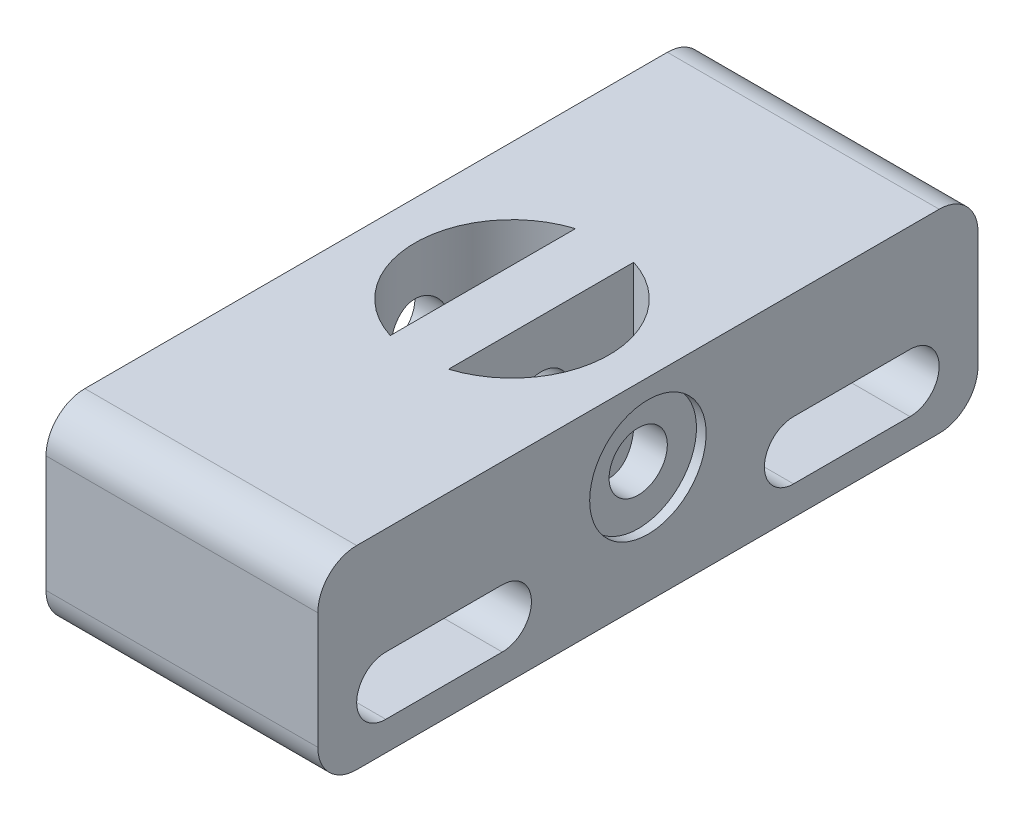
from build123d import *

# Parameters (mm, degrees)
SKETCH_1_W          = 14
SKETCH_1_H          = 34
EXTRUDE_1_DEPTH     = 10
SKETCH_2_R          = 1.5
CUT_EXTRUDE_1_DEPTH = 25.186773245
SKETCH_3_R          = 3
CUT_EXTRUDE_2_DEPTH = 0.5
CUT_EXTRUDE_3_DEPTH = 25.186773286
FILLET_1_R          = 2
CHAMFER_1_SIZE      = 0.6


with BuildPart() as part:
    # 草图1 → 凸台-拉伸1 (new body)
    with BuildSketch(Plane(origin=(0, 0, 0), x_dir=(1, 0, 0), z_dir=(0, 1, 0))):
        Rectangle(SKETCH_1_W, SKETCH_1_H)
        with BuildLine():
            Line((-1.5, 4.769696007), (-1.5, -4.769696007))
            ThreePointArc((-1.5, -4.769696007), (-5, 0), (-1.5, 4.769696007))
        make_face(mode=Mode.SUBTRACT)
        with BuildLine():
            Line((1.5, 4.769696007), (1.5, -4.769696007))
            ThreePointArc((1.5, -4.769696007), (5, 0), (1.5, 4.769696007))
        make_face(mode=Mode.SUBTRACT)
    extrude(amount=EXTRUDE_1_DEPTH)

    # 草图2 → 切除-拉伸1 (cut, through all)
    with BuildSketch(Plane.ZY.offset(7)):
        with Locations((0, 6)):
            Circle(SKETCH_2_R)
    extrude(amount=-CUT_EXTRUDE_1_DEPTH, mode=Mode.SUBTRACT)

    # 草图3 → 切除-拉伸2 (cut)
    with BuildSketch(Plane.ZY.offset(7)):
        with Locations((0, 6)):
            Circle(SKETCH_3_R)
    cut_extrude_2 = extrude(amount=-CUT_EXTRUDE_2_DEPTH, mode=Mode.SUBTRACT)

    # 镜向1: 切除-拉伸2 across plane
    add(cut_extrude_2.mirror(Plane(origin=(0, 0, 0), x_dir=(0, 0, 1), z_dir=(1, 0, 0))), mode=Mode.SUBTRACT)

    # 草图4 → 切除-拉伸3 (cut, through all)
    with BuildSketch(Plane.ZY.offset(7)):
        with BuildLine():
            Line((-13.5, 4.5), (-7.5, 4.5))
            ThreePointArc((-7.5, 4.5), (-6, 3), (-7.5, 1.5))
            Line((-7.5, 1.5), (-13.5, 1.5))
            ThreePointArc((-13.5, 1.5), (-15, 3), (-13.5, 4.5))
        make_face()
        with BuildLine():
            Line((7.5, 1.5), (13.5, 1.5))
            ThreePointArc((13.5, 1.5), (15, 3), (13.5, 4.5))
            Line((13.5, 4.5), (7.5, 4.5))
            ThreePointArc((7.5, 4.5), (6, 3), (7.5, 1.5))
        make_face()
    extrude(amount=-CUT_EXTRUDE_3_DEPTH, mode=Mode.SUBTRACT)

    # 圆角1
    fillet_1_edges = [part.edges().sort_by_distance(p)[0] for p in [
        (0, 10, 17),
        (0, 0, 17),
        (0, 0, -17),
        (0, 10, -17),
    ]]
    fillet(fillet_1_edges, radius=FILLET_1_R)

    # 倒角1
    chamfer_1_edges = [part.edges().sort_by_distance(p)[0] for p in [
        (5, 0, 0),
        (1.5, 0, 0),
        (-5, 0, 0),
        (-1.5, 0, 0),
    ]]
    chamfer(chamfer_1_edges, length=CHAMFER_1_SIZE)


solid = part.part
